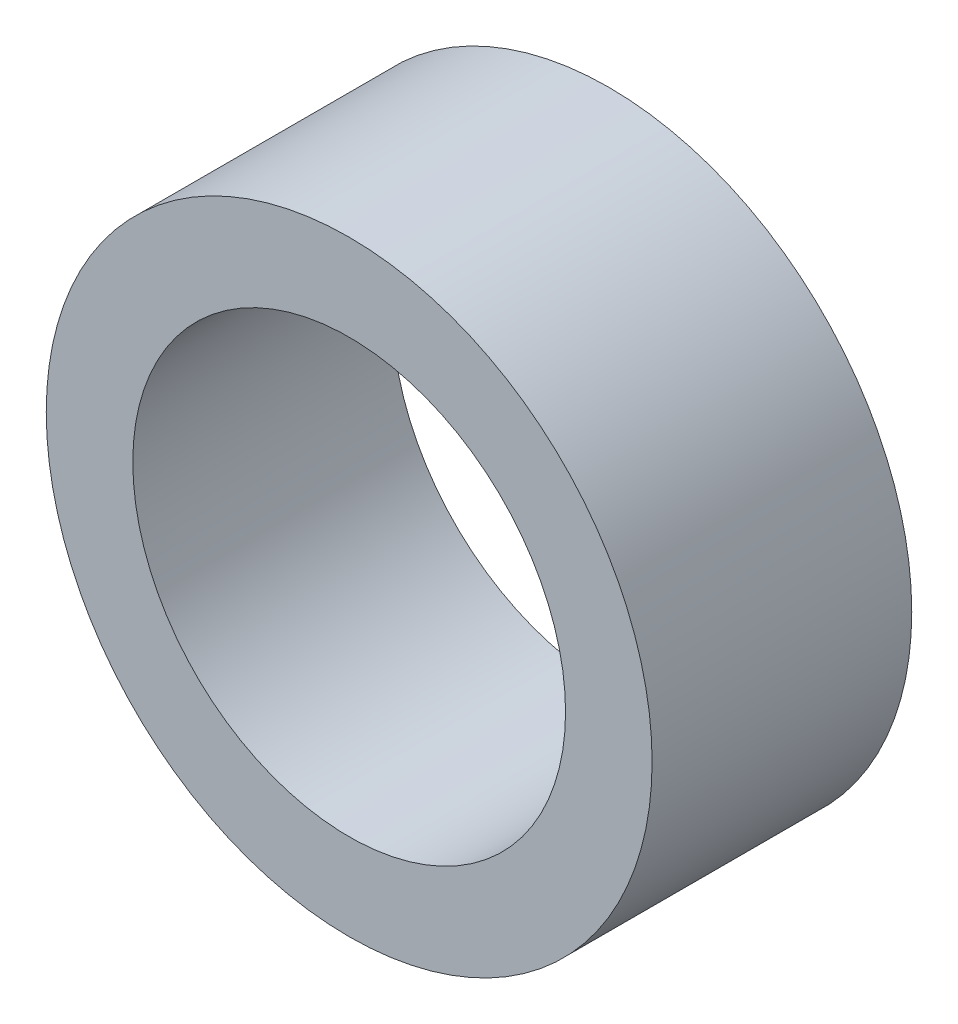
from build123d import *

# Parameters (mm, degrees)
BOSS_EXTRUDE1_START = 19.05
SKETCH1_R           = 44.45
SKETCH1_R_2         = 31.75
BOSS_EXTRUDE1_DEPTH = 38.1


with BuildPart() as part:
    # Sketch1 → Boss-Extrude1 (new body)
    with BuildSketch(Plane.XY.offset(BOSS_EXTRUDE1_START)):
        Circle(SKETCH1_R)
        Circle(SKETCH1_R_2, mode=Mode.SUBTRACT)
    extrude(amount=-BOSS_EXTRUDE1_DEPTH)


solid = part.part
